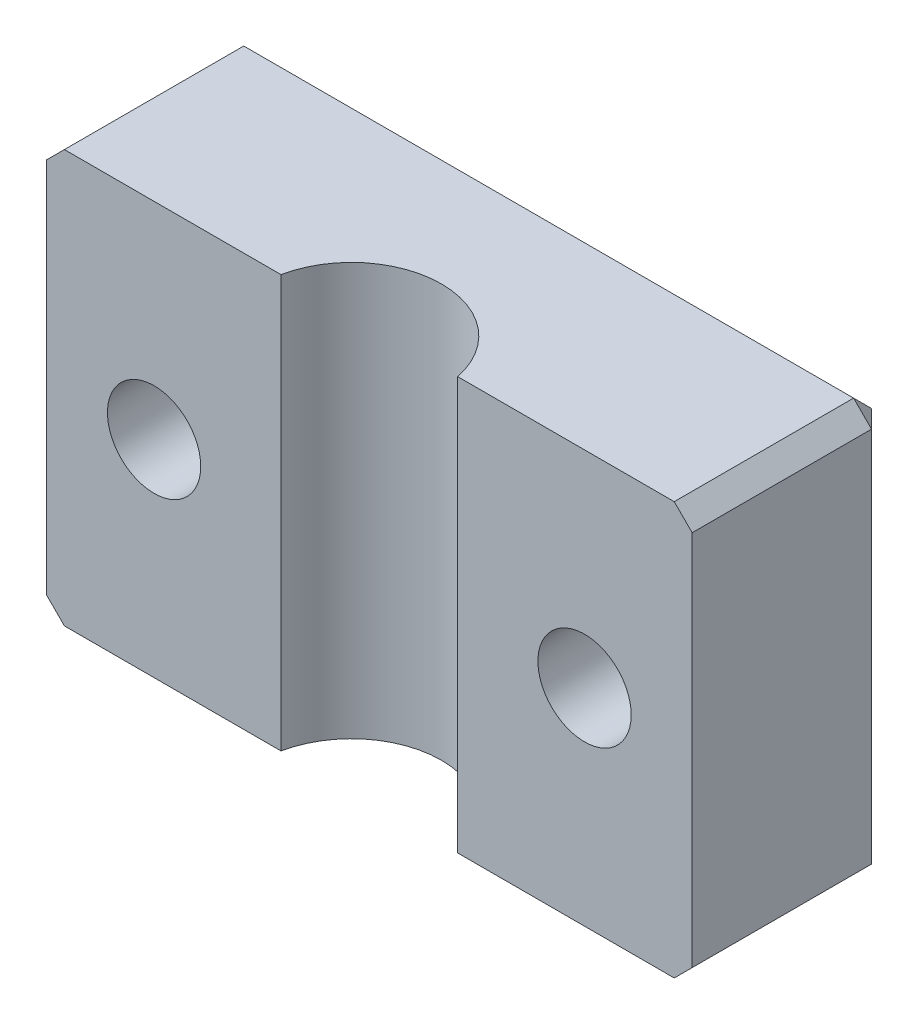
from build123d import *

# Parameters (mm, degrees)
BOSS_EXTRUDE1_DEPTH = 23
CUT_EXTRUDE1_REACH  = 33.209
SKETCH2_R           = 2.6
CHAMFER1_SIZE       = 1


with BuildPart() as part:
    # Sketch1 → Boss-Extrude1 (new body)
    with BuildSketch(Plane(origin=(0, 0, 0), x_dir=(1, 0, 0), z_dir=(0, 1, 0))):
        with BuildLine():
            Line((-18, 0), (18, 0))
            Line((18, 0), (18, -11))
            Line((18, -11), (4.92449236, -11))
            ThreePointArc((4.92449236, -11), (0, -6.975), (-4.92449236, -11))
            Line((-4.92449236, -11), (-18, -11))
            Line((-18, -11), (-18, 0))
        make_face()
    extrude(amount=BOSS_EXTRUDE1_DEPTH)

    # Sketch2 → Cut-Extrude1 (cut, up to next)
    with BuildSketch(Plane.XY.offset(11), mode=Mode.PRIVATE) as cut_extrude1_sk1:
        with Locations((-12, 11.5)):
            Circle(SKETCH2_R)
    cut_extrude1_tool1 = extrude(cut_extrude1_sk1.sketch, amount=-CUT_EXTRUDE1_REACH, mode=Mode.PRIVATE) & part.part
    # Sketch2 → Cut-Extrude1 (cut, up to next)
    with BuildSketch(Plane.XY.offset(11), mode=Mode.PRIVATE) as cut_extrude1_sk2:
        with Locations((12, 11.5)):
            Circle(SKETCH2_R)
    cut_extrude1_tool2 = extrude(cut_extrude1_sk2.sketch, amount=-CUT_EXTRUDE1_REACH, mode=Mode.PRIVATE) & part.part
    add(cut_extrude1_tool1.solids().sort_by_distance((-12, 11.5, 11))[0], mode=Mode.SUBTRACT)
    add(cut_extrude1_tool2.solids().sort_by_distance((12, 11.5, 11))[0], mode=Mode.SUBTRACT)

    # Chamfer1
    chamfer1_edges = [part.edges().sort_by_distance(p)[0] for p in [
        (-18, 11.5, 0),
        (18, 11.5, 0),
        (18, 23, 5.5),
        (0, 23, 0),
        (-18, 23, 5.5),
        (0, 0, 0),
        (18, 0, 5.5),
        (-18, 0, 5.5),
    ]]
    chamfer(chamfer1_edges, length=CHAMFER1_SIZE)


solid = part.part
